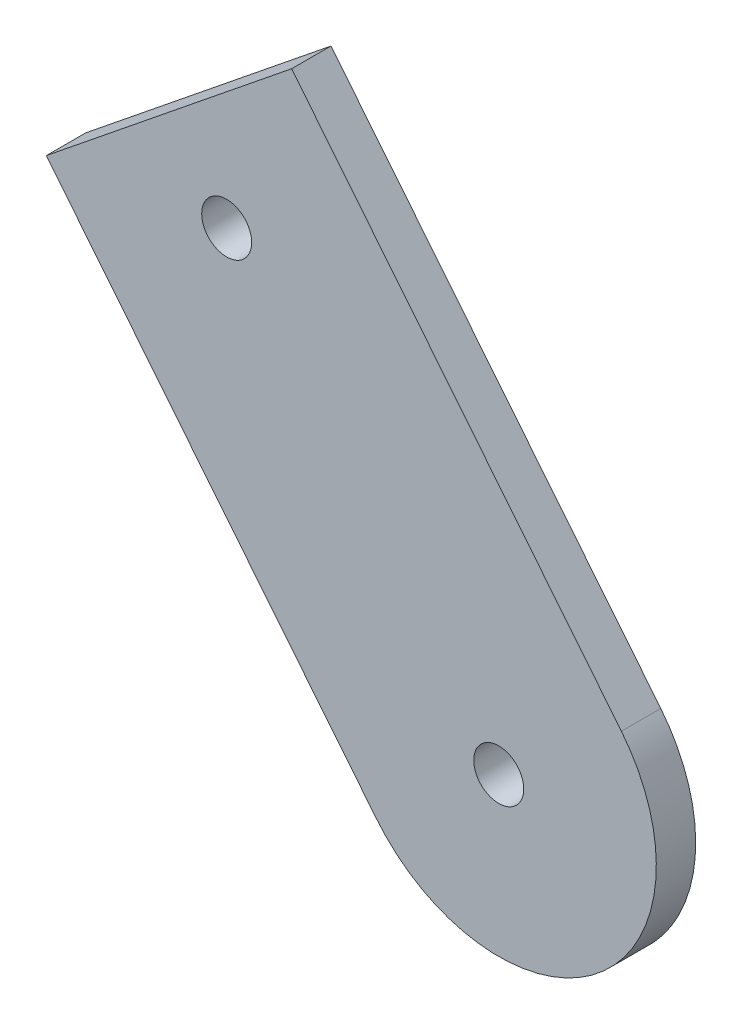
from build123d import *

# Parameters (mm, degrees)
ESQUISSE1_R        = 1.902389191
BOSS_EXTRU_1_DEPTH = 3


with BuildPart() as part:
    # Esquisse1 → Boss.-Extru.1 (new body)
    with BuildSketch(Plane(origin=(0, 0, 48.781012584), x_dir=(-1, 0, 0), z_dir=(0, 0, -1))):
        with BuildLine():
            Line((-246.569633903, 56.844858091), (-221.455699093, 87.978285117))
            Line((-221.455699093, 87.978285117), (-202.775642878, 72.909924232))
            Line((-202.775642878, 72.909924232), (-227.889577687, 41.776497206))
            ThreePointArc((-227.889577687, 41.776497206), (-244.763786238, 39.970649541), (-246.569633903, 56.844858091))
        make_face()
        with Locations((-237.229605795, 49.310677648)):
            Circle(ESQUISSE1_R, mode=Mode.SUBTRACT)
        with Locations((-216.510609577, 74.995754945)):
            Circle(ESQUISSE1_R, mode=Mode.SUBTRACT)
    extrude(amount=BOSS_EXTRU_1_DEPTH)


solid = part.part
